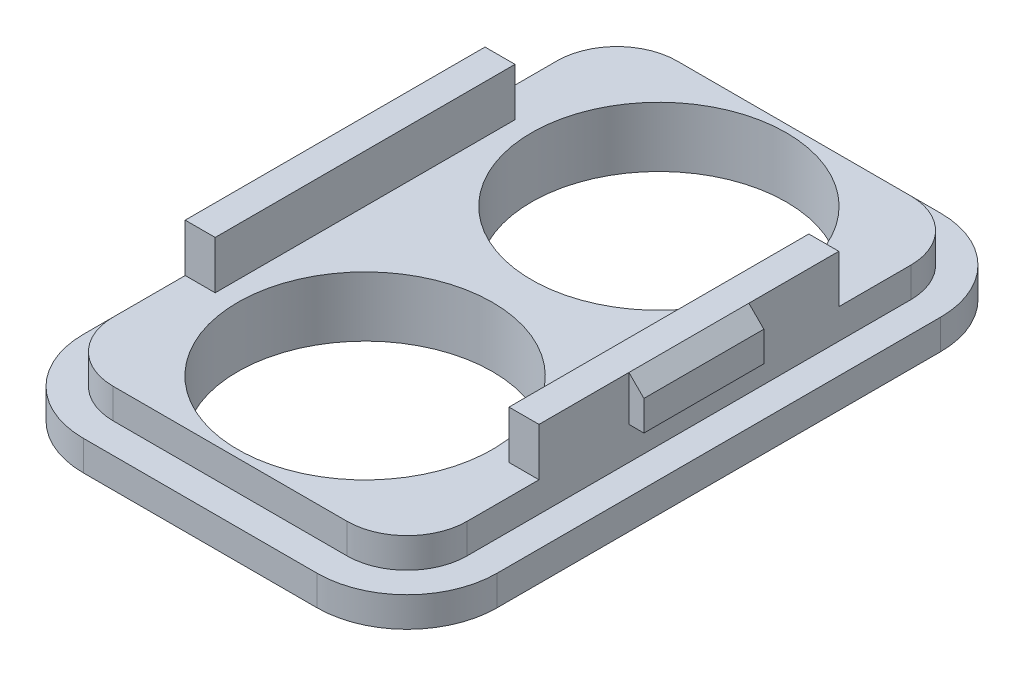
from build123d import *

# Parameters (mm, degrees)
EXTRUDE_1_DEPTH                           = 1
SKETCH_2_W                                = 1
SKETCH_2_H                                = 10
EXTRUDE_2_DEPTH                           = 1.6
EXTRUDE_3_DEPTH                           = 2
EXTRUDE_4_DEPTH                           = 1
MIRROR_1_AT_THE_SECOND_PLANE_COPY_1_DEPTH = 2
SKETCH_5_R                                = 4.25
CUT_EXTRUDE_1_DEPTH                       = 24.850366873


with BuildPart() as part:
    # 草图1 → 凸台-拉伸1 (new body)
    with BuildSketch(Plane(origin=(0, 0, 0), x_dir=(1, 0, 0), z_dir=(0, 1, 0))):
        with BuildLine():
            Line((2, 0), (9.8, 0))
            ThreePointArc((9.8, 0), (11.214213562, 0.585786438), (11.8, 2))
            Line((11.8, 2), (11.8, 16.8))
            ThreePointArc((11.8, 16.8), (11.214213562, 18.214213562), (9.8, 18.8))
            Line((9.8, 18.8), (2, 18.8))
            ThreePointArc((2, 18.8), (0.585786438, 18.214213562), (0, 16.8))
            Line((0, 16.8), (0, 2))
            ThreePointArc((0, 2), (0.585786438, 0.585786438), (2, 0))
        make_face()
    extrude(amount=EXTRUDE_1_DEPTH)

    # 草图2 → 凸台-拉伸2 (add)
    with BuildSketch(Plane(origin=(0, 1, 0), x_dir=(1, 0, 0), z_dir=(0, 1, 0))):
        with Locations((0.5, 9.4)):
            Rectangle(SKETCH_2_W, SKETCH_2_H)
        with Locations((11.3, 9.4)):
            Rectangle(SKETCH_2_W, SKETCH_2_H)
    extrude(amount=EXTRUDE_2_DEPTH)

    # 草图3 → 凸台-拉伸3 (add, symmetric)
    with BuildSketch(Plane.XY.offset(-9.4)):
        Polygon((0, 2.6), (0, 1.1), (-0.5, 1.1), (-0.5, 2.1), align=None)
    extrude_3 = extrude(amount=EXTRUDE_3_DEPTH, both=True)

    # 草图4 → 凸台-拉伸4 (add)
    with BuildSketch(Plane.XZ):
        with BuildLine():
            Line((2, -19.8), (9.8, -19.8))
            ThreePointArc((9.8, -19.8), (11.921320344, -18.921320344), (12.8, -16.8))
            Line((12.8, -16.8), (12.8, -2))
            ThreePointArc((12.8, -2), (11.921320344, 0.121320344), (9.8, 1))
            Line((9.8, 1), (2, 1))
            ThreePointArc((2, 1), (-0.121320344, 0.121320344), (-1, -2))
            Line((-1, -2), (-1, -16.8))
            ThreePointArc((-1, -16.8), (-0.121320344, -18.921320344), (2, -19.8))
        make_face()
    extrude(amount=EXTRUDE_4_DEPTH)

    # 镜向1: 凸台-拉伸3 across plane
    add(extrude_3.mirror(Plane.XY.offset(-9.4)))

    # 镜向1 at the second plane: 凸台-拉伸3 across plane
    add(extrude_3.mirror(Plane.ZY.offset(-5.9)))

    # 镜向1 at the second plane copy 1 sket → 镜向1 at the second plane copy 1 (add, symmetric)
    with BuildSketch(Plane(origin=(11.8, 0, -9.4), x_dir=(-1, 0, 0), z_dir=(0, 0, -1))):
        Polygon((0, 2.6), (0, 1.1), (-0.5, 1.1), (-0.5, 2.1), align=None)
    extrude(amount=MIRROR_1_AT_THE_SECOND_PLANE_COPY_1_DEPTH, both=True)

    # 草图5 → 切除-拉伸1 (cut, through all)
    with BuildSketch(Plane.XZ.offset(1)):
        with Locations(Location((5.9, -4.5, 0), (0, 0, 270))):
            Circle(SKETCH_5_R)
        with Locations(Location((5.9, -14.3, 0), (0, 0, 270))):
            Circle(SKETCH_5_R)
    extrude(amount=-CUT_EXTRUDE_1_DEPTH, mode=Mode.SUBTRACT)


solid = part.part
